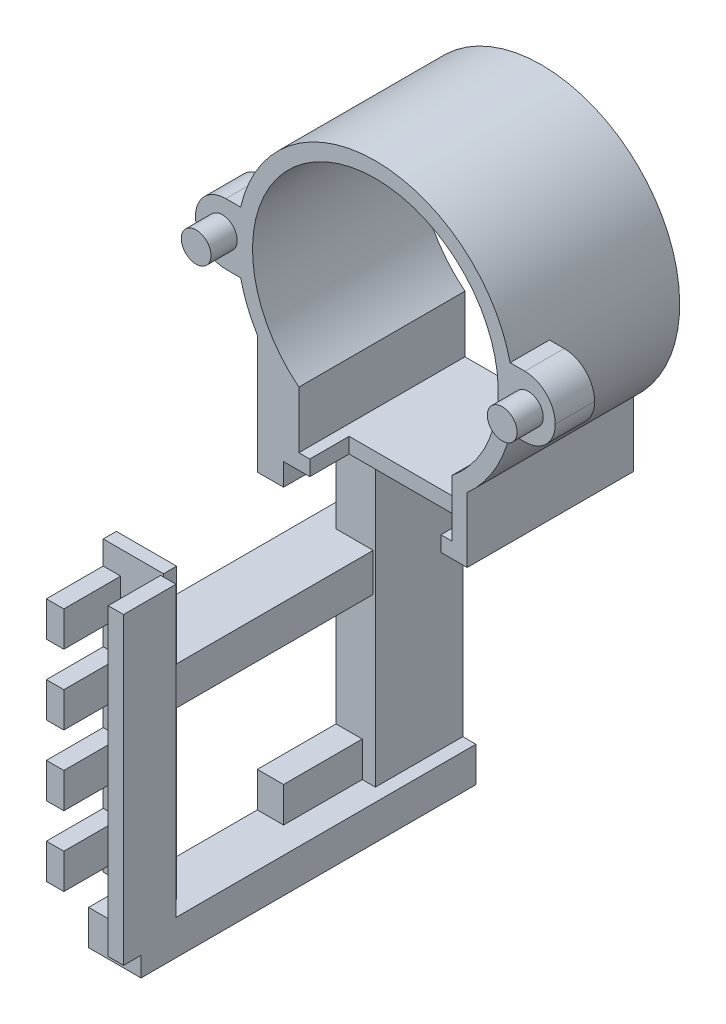
from build123d import *

# Parameters (mm, degrees)
BOSS_EXTRU_1_DEPTH      = 19
ESQUISSE2_R             = 1.7
BOSS_EXTRU_8_DEPTH      = 4.5
ESQUISSE2_4_R           = 1.7
BOSS_EXTRU_9_DEPTH      = 3
ESQUISSE5_W             = 15
ESQUISSE5_H             = 4.5
ENL_V_MAT_EXTRU_1_DEPTH = 1.75
ESQUISSE20_W            = 19
ESQUISSE20_H            = 3.718185323
BOSS_EXTRU_18_DEPTH     = 3
ESQUISSE21_W            = 3
ESQUISSE21_H            = 19
BOSS_EXTRU_19_DEPTH     = 40
ESQUISSE22_W            = 19
ESQUISSE22_H            = 4
BOSS_EXTRU_20_DEPTH     = 3
ESQUISSE23_W            = 6
ESQUISSE23_H            = 4
BOSS_EXTRU_21_DEPTH     = 19.3
ESQUISSE24_W            = 1.75
ESQUISSE24_H            = 4
BOSS_EXTRU_22_DEPTH     = 33
ESQUISSE25_W            = 2
ESQUISSE25_H            = 4.324516653
ENL_V_MAT_EXTRU_6_DEPTH = 1.75
ESQUISSE26_W            = 3.2
ESQUISSE26_H            = 1.5
BOSS_EXTRU_23_DEPTH     = 5
ESQUISSE27_W            = 1.5
ESQUISSE27_H            = 5
BOSS_EXTRU_24_DEPTH     = 3.7
BOSS_EXTRU_26_REACH     = 63.655
ESQUISSE29_W            = 3
ESQUISSE29_H            = 19
ESQUISSE30_W            = 1.499569939
ESQUISSE30_H            = 10
BOSS_EXTRU_27_DEPTH     = 36
ESQUISSE31_W            = 3
ESQUISSE31_H            = 36.935070483
ENL_V_MAT_EXTRU_7_DEPTH = 9
ESQUISSE32_W            = 3
ESQUISSE32_H            = 9
BOSS_EXTRU_28_DEPTH     = 7.5
ESQUISSE33_W            = 6.9
ESQUISSE33_H            = 1.5
BOSS_EXTRU_29_DEPTH     = 28
ESQUISSE34_W            = 6.9
ESQUISSE34_H            = 4.363408043
BOSS_EXTRU_30_DEPTH     = 22.475483347
ESQUISSE35_W            = 2.65
ESQUISSE35_H            = 4.363408043
BOSS_EXTRU_31_DEPTH     = 10
ESQUISSE36_W            = 2
ESQUISSE36_H            = 4
BOSS_EXTRU_32_DEPTH     = 6.5
ESQUISSE37_W            = 1.75
ESQUISSE37_H            = 34.75
BOSS_EXTRU_33_DEPTH     = 2


with BuildPart() as part:
    # Esquisse1 → Boss.-Extru.1 (new body)
    with BuildSketch(Plane.XY):
        with BuildLine():
            Line((-10.5, -11.806354221), (-10.5, -19.242724867))
            Line((-10.5, -19.242724867), (10.5, -19.242724867))
            Line((10.5, -19.242724867), (10.5, -11.806354221))
            ThreePointArc((10.5, -11.806354221), (0, 15.8), (-10.5, -11.806354221))
        make_face()
        with BuildLine():
            Line((-8.75, -10.992724867), (-8.75, -17.492724867))
            Line((-8.75, -17.492724867), (8.75, -17.492724867))
            Line((8.75, -17.492724867), (8.75, -10.992724867))
            ThreePointArc((8.75, -10.992724867), (0, 14.05), (-8.75, -10.992724867))
        make_face(mode=Mode.SUBTRACT)
    extrude(amount=BOSS_EXTRU_1_DEPTH)



with BuildPart() as body_2:
    # Esquisse2 → Boss.-Extru.8 (new body)
    # profile 1 of 4: a face of its own
    with BuildSketch(Plane.XY.offset(19)):
        with BuildLine():
            ThreePointArc((-15.8, 0), (-15.70155977, 1.760971547), (-15.407465723, 3.5))
            Line((-15.407465723, 3.5), (-17.095274292, 3.5))
            ThreePointArc((-17.095274292, 3.5), (-19.561128115, 2.473312424), (-20.569715298, 0))
            ThreePointArc((-20.569715298, 0), (-19.561128115, -2.473312424), (-17.095274292, -3.5))
            Line((-17.095274292, -3.5), (-15.407465723, -3.5))
            ThreePointArc((-15.407465723, -3.5), (-15.70155977, -1.760971547), (-15.8, 0))
        make_face()
        with Locations((-17.5, 0)):
            Circle(ESQUISSE2_R, mode=Mode.SUBTRACT)
    # profile 2 of 4: a face of its own
    with BuildSketch(Plane.XY.offset(19)):
        with BuildLine():
            Line((17.095274292, 3.5), (15.407465723, 3.5))
            ThreePointArc((15.407465723, 3.5), (15.70155977, 1.76097155), (15.8, 5e-09))
            ThreePointArc((15.8, 5e-09), (15.70155977, -1.760971545), (15.407465723, -3.5))
            Line((15.407465723, -3.5), (17.095274292, -3.5))
            ThreePointArc((17.095274292, -3.5), (19.561128115, -2.473312424), (20.569715298, 0))
            ThreePointArc((20.569715298, 0), (19.561128115, 2.473312424), (17.095274292, 3.5))
        make_face()
        with BuildLine():
            ThreePointArc((19.2, 0), (17.499999997, -1.7), (15.8, 5e-09))
            ThreePointArc((15.8, 5e-09), (17.500000003, 1.7), (19.2, 0))
        make_face(mode=Mode.SUBTRACT)
    # profile 3 of 4: a face of its own
    with BuildSketch(Plane.XY.offset(19)):
        with Locations((-17.5, 0)):
            Circle(ESQUISSE2_R)
    # profile 4 of 4: a face of its own
    with BuildSketch(Plane.XY.offset(19)):
        with Locations((17.5, 0)):
            Circle(ESQUISSE2_R)
    extrude(amount=-BOSS_EXTRU_8_DEPTH)


with BuildPart() as part_1:
    add(part.part)

    add(body_2.part)  # Boss.-Extru.9 merges body 2
    # Esquisse2<4> → Boss.-Extru.9 (add)
    with BuildSketch(Plane.XY.offset(19)):
        with Locations((-17.5, 0)):
            Circle(ESQUISSE2_4_R)
        with Locations((17.5, 0)):
            Circle(ESQUISSE2_4_R)
    extrude(amount=BOSS_EXTRU_9_DEPTH)

    # Esquisse5 → Enlèv. mat.-Extru.1 (cut)
    with BuildSketch(Plane.XZ.offset(19.242724867)):
        with Locations((0, 16.75)):
            Rectangle(ESQUISSE5_W, ESQUISSE5_H)
    extrude(amount=-ENL_V_MAT_EXTRU_1_DEPTH, mode=Mode.SUBTRACT)

    # Esquisse20 → Boss.-Extru.18 (add)
    with BuildSketch(Plane.ZY.offset(10.5)):
        with Locations((9.5, -17.383632205)):
            Rectangle(ESQUISSE20_W, ESQUISSE20_H)
    extrude(amount=BOSS_EXTRU_18_DEPTH)

    # Esquisse21 → Boss.-Extru.19 (add)
    with BuildSketch(Plane.XZ.offset(19.242724867)):
        with Locations((-12, 9.5)):
            Rectangle(ESQUISSE21_W, ESQUISSE21_H)
    extrude(amount=BOSS_EXTRU_19_DEPTH)

    # Esquisse22 → Boss.-Extru.20 (add)
    with BuildSketch(Plane(origin=(-10.5, 0, 0), x_dir=(0, 0, -1), z_dir=(1, 0, 0))):
        with Locations((-9.5, -57.242724867)):
            Rectangle(ESQUISSE22_W, ESQUISSE22_H)
    extrude(amount=BOSS_EXTRU_20_DEPTH)

    # Esquisse23 → Boss.-Extru.21 (add)
    with BuildSketch(Plane.XY.offset(19)):
        with Locations((-10.5, -57.242724867)):
            Rectangle(ESQUISSE23_W, ESQUISSE23_H)
    extrude(amount=BOSS_EXTRU_21_DEPTH)

    # Esquisse24 → Boss.-Extru.22 (add)
    with BuildSketch(Plane(origin=(0, -55.242724867, 0), x_dir=(1, 0, 0), z_dir=(0, 1, 0))):
        with Locations((-8.375, -36.3)):
            Rectangle(ESQUISSE24_W, ESQUISSE24_H)
    extrude(amount=BOSS_EXTRU_22_DEPTH)

    # Esquisse25 → Enlèv. mat.-Extru.6 (cut)
    with BuildSketch(Plane(origin=(0, -55.242724867, 0), x_dir=(1, 0, 0), z_dir=(0, 1, 0))):
        with Locations((-10.25, -36.137741674)):
            Rectangle(ESQUISSE25_W, ESQUISSE25_H)
    extrude(amount=-ENL_V_MAT_EXTRU_6_DEPTH, mode=Mode.SUBTRACT)

    # Esquisse26 → Boss.-Extru.23 (add)
    with BuildSketch(Plane(origin=(0, -55.242724867, 0), x_dir=(1, 0, 0), z_dir=(0, 1, 0))):
        with Locations((-10.85, -33.225483347)):
            Rectangle(ESQUISSE26_W, ESQUISSE26_H)
    extrude(amount=BOSS_EXTRU_23_DEPTH)

    # Esquisse27 → Boss.-Extru.24 (add)
    with BuildSketch(Plane.ZY.offset(12.45)):
        with Locations((33.225483347, -52.742724867)):
            Rectangle(ESQUISSE27_W, ESQUISSE27_H)
    extrude(amount=BOSS_EXTRU_24_DEPTH)

    # Esquisse29 → Boss.-Extru.26 (add, up to next)
    with BuildSketch(Plane(origin=(0, -15.524539544, 0), x_dir=(1, 0, 0), z_dir=(0, 1, 0)), mode=Mode.PRIVATE) as boss_extru_26_sk1:
        with Locations((-12, -9.5)):
            Rectangle(ESQUISSE29_W, ESQUISSE29_H)
    boss_extru_26_tool1 = extrude(boss_extru_26_sk1.sketch, amount=BOSS_EXTRU_26_REACH, mode=Mode.PRIVATE) - part_1.part
    add(boss_extru_26_tool1.solids().sort_by_distance((-12, -15.52454, 9.5))[0])

    # Esquisse30 → Boss.-Extru.27 (add)
    with BuildSketch(Plane.XZ.offset(19.242724867)):
        with Locations((-9.750215031, 5)):
            Rectangle(ESQUISSE30_W, ESQUISSE30_H)
    extrude(amount=BOSS_EXTRU_27_DEPTH)

    # Esquisse31 → Enlèv. mat.-Extru.7 (cut)
    with BuildSketch(Plane.XY.offset(19)):
        with Locations((-12, -40.258799307)):
            Rectangle(ESQUISSE31_W, ESQUISSE31_H)
    extrude(amount=-ENL_V_MAT_EXTRU_7_DEPTH, mode=Mode.SUBTRACT)

    # Esquisse32 → Boss.-Extru.28 (add)
    with BuildSketch(Plane(origin=(0, -58.726334549, 0), x_dir=(1, 0, 0), z_dir=(0, 1, 0))):
        with Locations((-12, -14.5)):
            Rectangle(ESQUISSE32_W, ESQUISSE32_H)
    extrude(amount=BOSS_EXTRU_28_DEPTH)

    # Esquisse33 → Boss.-Extru.29 (add)
    with BuildSketch(Plane(origin=(0, -50.242724867, 0), x_dir=(1, 0, 0), z_dir=(0, 1, 0))):
        with Locations((-12.7, -33.225483347)):
            Rectangle(ESQUISSE33_W, ESQUISSE33_H)
    extrude(amount=BOSS_EXTRU_29_DEPTH)

    # Esquisse34 → Boss.-Extru.30 (add)
    with BuildSketch(Plane(origin=(0, 0, 32.475483347), x_dir=(-1, 0, 0), z_dir=(0, 0, -1))):
        with Locations((12.7, -34.093482268)):
            Rectangle(ESQUISSE34_W, ESQUISSE34_H)
    extrude(amount=BOSS_EXTRU_30_DEPTH)

    # Esquisse35 → Boss.-Extru.31 (add)
    with BuildSketch(Plane(origin=(0, 0, 10), x_dir=(-1, 0, 0), z_dir=(0, 0, -1))):
        with Locations((14.825, -34.093482268)):
            Rectangle(ESQUISSE35_W, ESQUISSE35_H)
    extrude(amount=BOSS_EXTRU_31_DEPTH)

    # Esquisse36 → Boss.-Extru.32 (add)
    with BuildSketch(Plane.XY.offset(33.975483347)):
        with Locations((-15.15, -26.925726739)):
            Rectangle(ESQUISSE36_W, ESQUISSE36_H)
        with Locations((-15.15, -34.925726739)):
            Rectangle(ESQUISSE36_W, ESQUISSE36_H)
        with Locations((-15.15, -42.925726739)):
            Rectangle(ESQUISSE36_W, ESQUISSE36_H)
        with Locations((-15.15, -50.925726739)):
            Rectangle(ESQUISSE36_W, ESQUISSE36_H)
    extrude(amount=BOSS_EXTRU_32_DEPTH)

    # Esquisse37 → Boss.-Extru.33 (add)
    with BuildSketch(Plane.XY.offset(38.3)):
        with Locations((-8.375, -39.617724867)):
            Rectangle(ESQUISSE37_W, ESQUISSE37_H)
    extrude(amount=BOSS_EXTRU_33_DEPTH)


solid = part_1.part
